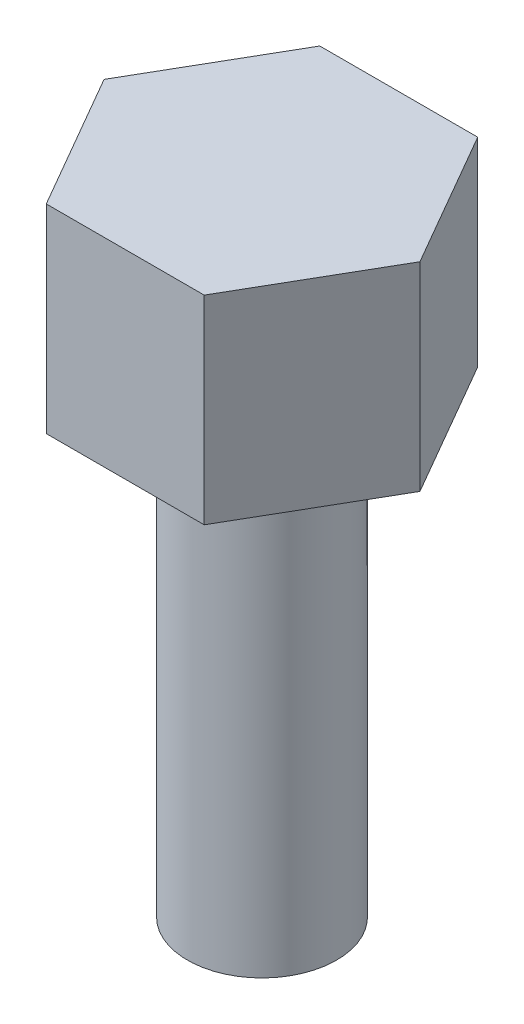
from build123d import *

# Parameters (mm, degrees)
BOSS_EXTRUDE1_DEPTH = 4
SKETCH2_R           = 1.5
BOSS_EXTRUDE2_DEPTH = 9


with BuildPart() as part:
    # Sketch1 → Boss-Extrude1 (new body)
    with BuildSketch(Plane(origin=(0, 0, 0), x_dir=(1, 0, 0), z_dir=(0, 1, 0))):
        Polygon((3.175426481, 0), (1.58771324, 2.75), (-1.58771324, 2.75), (-3.175426481, 0), (-1.58771324, -2.75), (1.58771324, -2.75), align=None)
    extrude(amount=BOSS_EXTRUDE1_DEPTH)

    # Sketch2 → Boss-Extrude2 (add)
    with BuildSketch(Plane.XZ):
        with Locations(Location((0, 0, 0), (0, 0, 270))):
            Circle(SKETCH2_R)
    extrude(amount=BOSS_EXTRUDE2_DEPTH)


solid = part.part
